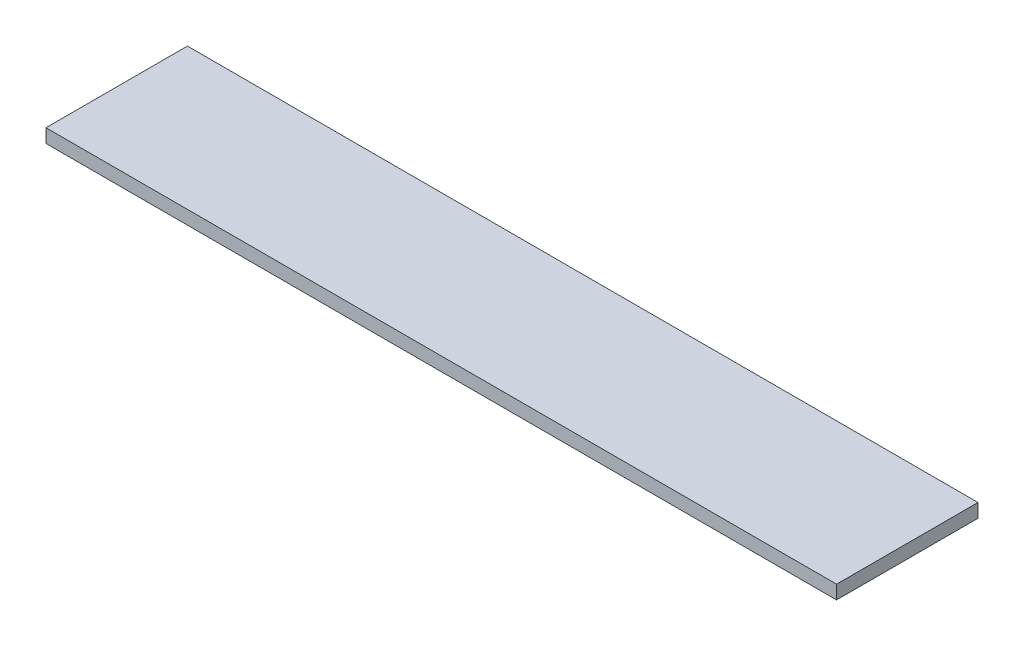
from build123d import *

# Parameters (mm, degrees)
SKETCH1_W           = 115.7
SKETCH1_H           = 20.7
BOSS_EXTRUDE1_DEPTH = 2


with BuildPart() as part:
    # Sketch1 → Boss-Extrude1 (new body)
    with BuildSketch(Plane(origin=(0, 0, 0), x_dir=(1, 0, 0), z_dir=(0, 1, 0))):
        Rectangle(SKETCH1_W, SKETCH1_H)
    extrude(amount=BOSS_EXTRUDE1_DEPTH)


solid = part.part
